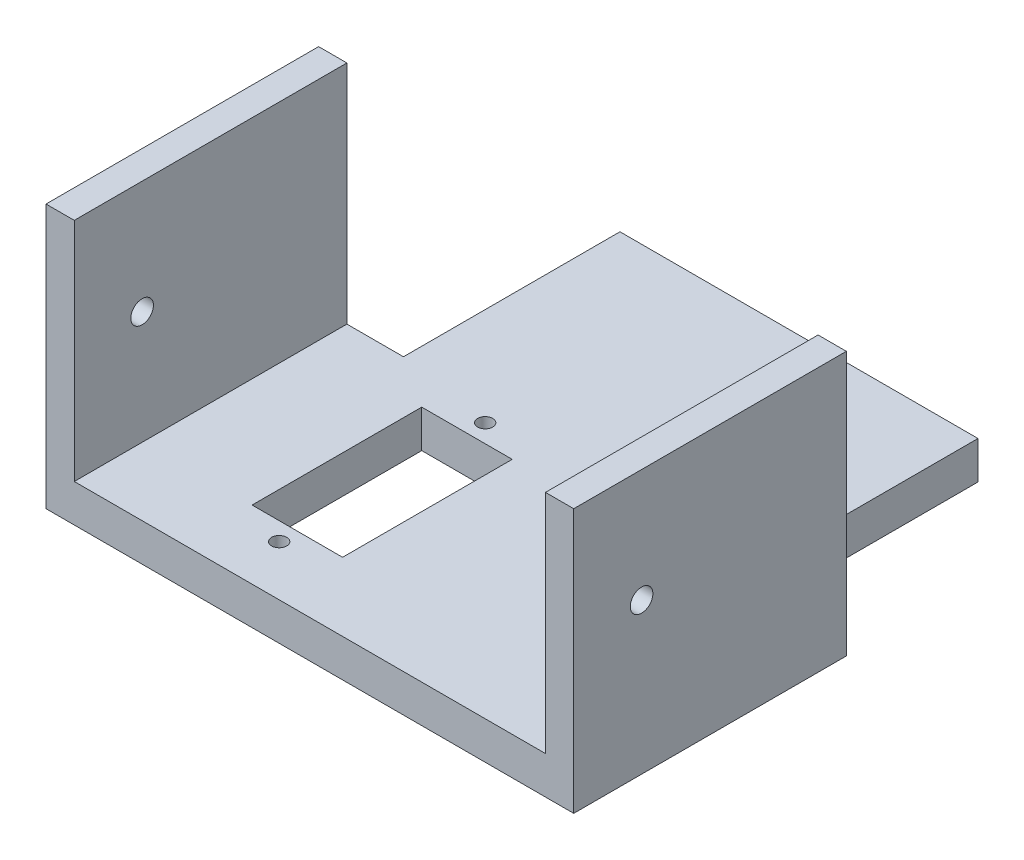
from build123d import *

# Parameters (mm, degrees)
SKETCH1_W           = 70
SKETCH1_H           = 150
BOSS_EXTRUDE1_DEPTH = 5
SKETCH7_W           = 3.75
SKETCH7_H           = 30
BOSS_EXTRUDE2_DEPTH = 90
SKETCH10_W          = 60
SKETCH10_H          = 5
CUT_EXTRUDE2_DEPTH  = 75
SKETCH11_R          = 1.5
CUT_EXTRUDE3_DEPTH  = 75
CUT_EXTRUDE4_DEPTH  = 40
SKETCH13_R          = 1
SKETCH13_W          = 12
SKETCH13_H          = 22.5
CUT_EXTRUDE5_DEPTH  = 35


with BuildPart() as part:
    # Sketch1 → Boss-Extrude1 (new body)
    with BuildSketch(Plane(origin=(0, 0, 0), x_dir=(1, 0, 0), z_dir=(0, 1, 0))):
        Rectangle(SKETCH1_W, SKETCH1_H)
    extrude(amount=BOSS_EXTRUDE1_DEPTH)

    # Sketch7 → Boss-Extrude2 (add)
    with BuildSketch(Plane(origin=(0, 0, -75), x_dir=(-1, 0, 0), z_dir=(0, 0, -1))):
        with Locations((-33.125, 20)):
            Rectangle(SKETCH7_W, SKETCH7_H)
        with Locations((33.125, 20)):
            Rectangle(SKETCH7_W, SKETCH7_H)
    extrude(amount=-BOSS_EXTRUDE2_DEPTH)

    # Sketch10 → Cut-Extrude2 (cut)
    with BuildSketch(Plane(origin=(35, 0, 0), x_dir=(0, 0, -1), z_dir=(1, 0, 0))):
        with Locations((-45, 2.5)):
            Rectangle(SKETCH10_W, SKETCH10_H)
    extrude(amount=-CUT_EXTRUDE2_DEPTH, mode=Mode.SUBTRACT)

    # Sketch11 → Cut-Extrude3 (cut)
    with BuildSketch(Plane.ZY.offset(35)):
        with Locations((6, 20)):
            Circle(SKETCH11_R)
    extrude(amount=-CUT_EXTRUDE3_DEPTH, mode=Mode.SUBTRACT)

    # Sketch12 → Cut-Extrude4 (cut)
    with BuildSketch(Plane.XZ):
        Polygon((35, -75), (35, -21.162236792), (23.74549434, -21.162236792), (23.74549434, -49.878747724), (0, -49.878747724), (0, -75), (23.74549434, -75), align=None)
        Polygon((0, -75), (0, -49.878747724), (-23.74549434, -49.878747724), (-23.74549434, -21.162236792), (-35, -21.162236792), (-35, -75), (-23.74549434, -75), align=None)
    extrude(amount=-CUT_EXTRUDE4_DEPTH, mode=Mode.SUBTRACT)

    # Sketch13 → Cut-Extrude5 (cut)
    with BuildSketch(Plane.XZ):
        with Locations(Location((-10.75, 8.32, 0), (0, 0, 270))):
            Circle(SKETCH13_R)
        with Locations(Location((-10.75, -19, 0), (0, 0, 270))):
            Circle(SKETCH13_R)
        with Locations((-10.75, -5.34)):
            Rectangle(SKETCH13_W, SKETCH13_H)
    extrude(amount=-CUT_EXTRUDE5_DEPTH, mode=Mode.SUBTRACT)


solid = part.part
